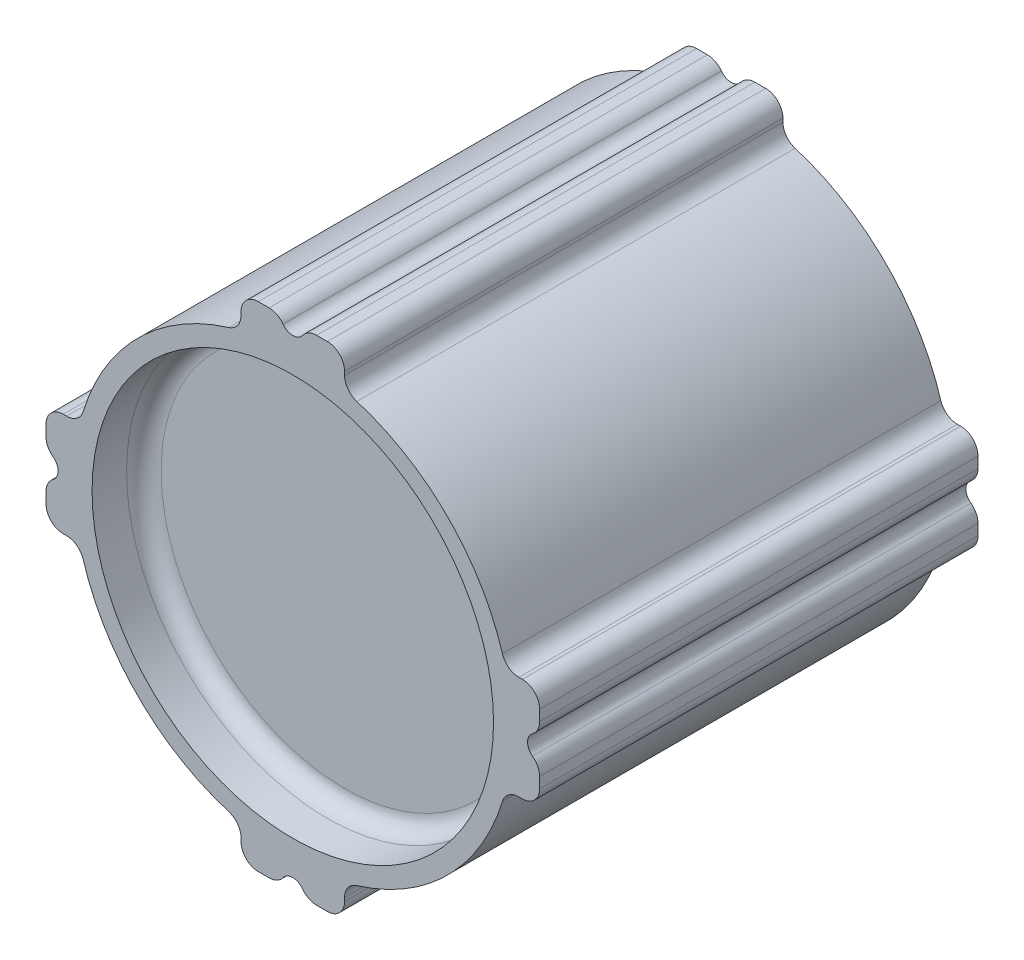
from build123d import *

# Parameters (mm, degrees)
SKETCH1_R           = 6.35
BOSS_EXTRUDE1_DEPTH = 12.7
SKETCH2_W           = 14.3
SKETCH2_H           = 3
BOSS_EXTRUDE2_DEPTH = 12.7
SKETCH3_W           = 3
SKETCH3_H           = 14.3
BOSS_EXTRUDE3_DEPTH = 12.7
SKETCH4_R           = 0.35
CUT_EXTRUDE2_DEPTH  = 12.7
FILLET1_R           = 0.5
FILLET2_R           = 0.5
CUT_EXTRUDE3_START  = 12.7
SKETCH5_R           = 5.815
CUT_EXTRUDE3_DEPTH  = 1.5
FILLET3_R           = 0.5
SKETCH7_R           = 3
CUT_EXTRUDE5_DEPTH  = 9.5
BOSS_EXTRUDE4_START = 1
SKETCH8_W           = 6
SKETCH8_H           = 1.56
BOSS_EXTRUDE4_DEPTH = 9.5
SKETCH6_R           = 5.565
CUT_EXTRUDE4_DEPTH  = 4.5


with BuildPart() as part:
    # Sketch1 → Boss-Extrude1 (new body)
    with BuildSketch(Plane.XY):
        Circle(SKETCH1_R)
    extrude(amount=BOSS_EXTRUDE1_DEPTH)

    # Sketch2 → Boss-Extrude2 (add)
    with BuildSketch(Plane.XY):
        Rectangle(SKETCH2_W, SKETCH2_H)
    extrude(amount=BOSS_EXTRUDE2_DEPTH)

    # Sketch3 → Boss-Extrude3 (add)
    with BuildSketch(Plane.XY):
        Rectangle(SKETCH3_W, SKETCH3_H)
    extrude(amount=BOSS_EXTRUDE3_DEPTH)

    # Sketch4 → Cut-Extrude2 (cut)
    with BuildSketch(Plane.XY):
        with Locations((0, 7.15)):
            Circle(SKETCH4_R)
        with Locations((7.15, 0)):
            Circle(SKETCH4_R)
        with Locations((-7.15, 0)):
            Circle(SKETCH4_R)
        with Locations((0, -7.15)):
            Circle(SKETCH4_R)
    extrude(amount=CUT_EXTRUDE2_DEPTH, mode=Mode.SUBTRACT)

    # Fillet1
    fillet1_edges = [part.edges().sort_by_distance(p)[0] for p in [
        (7.15, 1.5, 6.35),
        (-7.15, -1.5, 6.35),
        (7.15, -1.5, 6.35),
        (-7.15, 1.5, 6.35),
        (1.5, -7.15, 6.35),
        (-1.5, 7.15, 6.35),
        (1.5, 7.15, 6.35),
        (-1.5, -7.15, 6.35),
    ]]
    fillet(fillet1_edges, radius=FILLET1_R)

    # Fillet2
    fillet2_edges = [part.edges().sort_by_distance(p)[0] for p in [
        (-6.170291727, 1.5, 6.35),
        (6.170291727, 1.5, 6.35),
        (6.170291727, -1.5, 6.35),
        (-6.170291727, -1.5, 6.35),
        (1.5, 6.170291727, 6.35),
        (1.5, -6.170291727, 6.35),
        (-1.5, 6.170291727, 6.35),
        (-1.5, -6.170291727, 6.35),
        (0.35, 7.15, 6.35),
        (-0.35, 7.15, 6.35),
        (-0.35, -7.15, 6.35),
        (0.35, -7.15, 6.35),
        (7.15, -0.35, 6.35),
        (7.15, 0.35, 6.35),
        (-7.15, 0.35, 6.35),
        (-7.15, -0.35, 6.35),
    ]]
    fillet(fillet2_edges, radius=FILLET2_R)

    # Sketch5 → Cut-Extrude3 (cut)
    with BuildSketch(Plane.XY.offset(CUT_EXTRUDE3_START)):
        Circle(SKETCH5_R)
    extrude(amount=-CUT_EXTRUDE3_DEPTH, mode=Mode.SUBTRACT)

    # Fillet3
    fillet3_edges = [part.edges().sort_by_distance(p)[0] for p in [
        (-5.815, 0, 11.2),
    ]]
    fillet(fillet3_edges, radius=FILLET3_R)

    # Sketch7 → Cut-Extrude5 (cut)
    with BuildSketch(Plane.XY):
        Circle(SKETCH7_R)
    extrude(amount=CUT_EXTRUDE5_DEPTH, mode=Mode.SUBTRACT)

    # Sketch8 → Boss-Extrude4 (add)
    with BuildSketch(Plane.XY.offset(BOSS_EXTRUDE4_START)):
        with Locations((0, -2.22)):
            Rectangle(SKETCH8_W, SKETCH8_H)
    extrude(amount=BOSS_EXTRUDE4_DEPTH)

    # Sketch6 → Cut-Extrude4 (cut)
    with BuildSketch(Plane.XY):
        Circle(SKETCH6_R)
    extrude(amount=CUT_EXTRUDE4_DEPTH, mode=Mode.SUBTRACT)


solid = part.part
